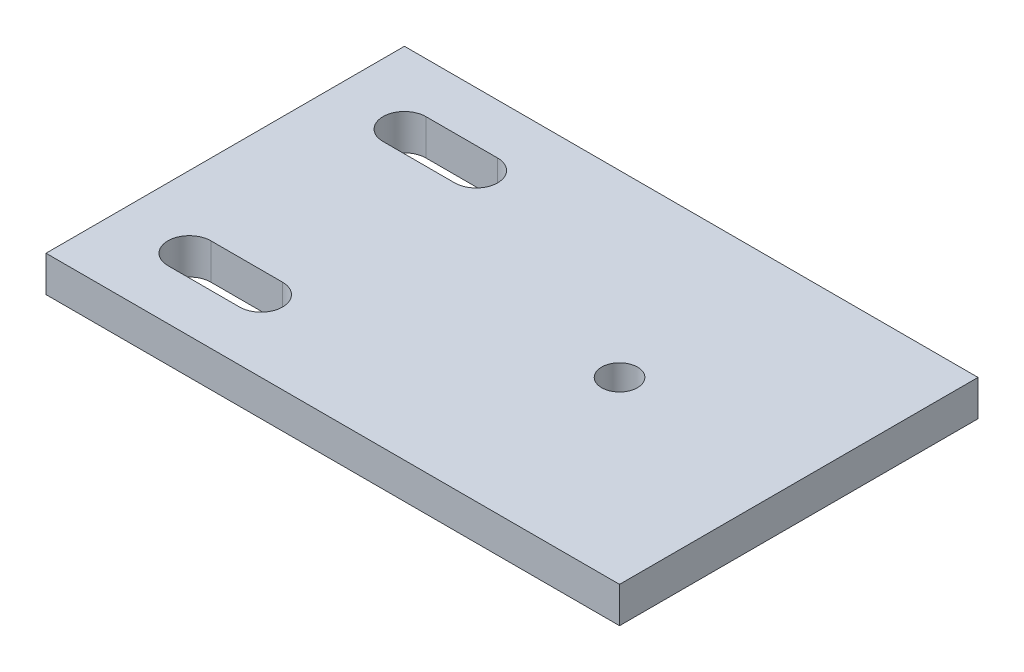
from build123d import *

# Parameters (mm, degrees)
SKETCH1_W           = 80
SKETCH1_H           = 50
SKETCH1_R           = 2.5
BOSS_EXTRUDE1_DEPTH = 5


with BuildPart() as part:
    # Sketch1 → Boss-Extrude1 (new body)
    with BuildSketch(Plane(origin=(0, 0, 0), x_dir=(1, 0, 0), z_dir=(0, 1, 0))):
        with Locations((40, 25)):
            Rectangle(SKETCH1_W, SKETCH1_H)
        with Locations(Location((55, 25, 0), (0, 0, 270))):
            Circle(SKETCH1_R, mode=Mode.SUBTRACT)
        with BuildLine():
            Line((10, 43), (20, 43))
            ThreePointArc((20, 43), (23, 40), (20, 37))
            Line((20, 37), (10, 37))
            ThreePointArc((10, 37), (7, 40), (10, 43))
        make_face(mode=Mode.SUBTRACT)
        with BuildLine():
            Line((10, 13), (20, 13))
            ThreePointArc((20, 13), (23, 10), (20, 7))
            Line((20, 7), (10, 7))
            ThreePointArc((10, 7), (7, 10), (10, 13))
        make_face(mode=Mode.SUBTRACT)
    extrude(amount=BOSS_EXTRUDE1_DEPTH)


solid = part.part
